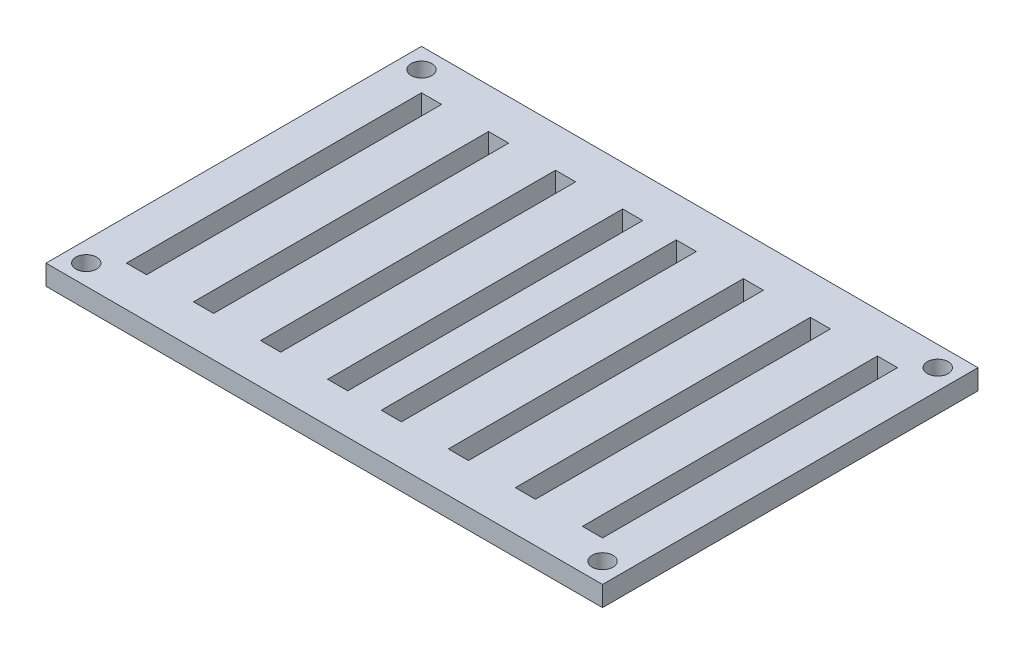
from build123d import *

# Parameters (mm, degrees)
SKETCH_1_W          = 83
SKETCH_1_H          = 56
SKETCH_1_R          = 1.55
EXTRUDE_1_DEPTH     = 3
SKETCH_3_W          = 3
SKETCH_3_H          = 44
CUT_EXTRUDE_1_DEPTH = 51.152268144


with BuildPart() as part:
    # ｽｹｯﾁ1 → ﾎﾞｽ - 押し出し1 (new body)
    with BuildSketch(Plane(origin=(0, 0, 0), x_dir=(1, 0, 0), z_dir=(0, 1, 0))):
        Rectangle(SKETCH_1_W, SKETCH_1_H)
        with Locations(Location((-38.5, 25, 0), (0, 0, 270))):
            Circle(SKETCH_1_R, mode=Mode.SUBTRACT)
        with Locations(Location((38.5, 25, 0), (0, 0, 270))):
            Circle(SKETCH_1_R, mode=Mode.SUBTRACT)
        with Locations(Location((38.5, -25, 0), (0, 0, 270))):
            Circle(SKETCH_1_R, mode=Mode.SUBTRACT)
        with Locations(Location((-38.5, -25, 0), (0, 0, 270))):
            Circle(SKETCH_1_R, mode=Mode.SUBTRACT)
    extrude(amount=EXTRUDE_1_DEPTH)

    # ｽｹｯﾁ3 → ｶｯﾄ - 押し出し1 (cut, through all)
    with BuildSketch(Plane(origin=(0, 3, 0), x_dir=(1, 0, 0), z_dir=(0, 1, 0))):
        with Locations((-34, 0)):
            Rectangle(SKETCH_3_W, SKETCH_3_H)
        with Locations((-24, 0)):
            Rectangle(SKETCH_3_W, SKETCH_3_H)
        with Locations((-14, 0)):
            Rectangle(SKETCH_3_W, SKETCH_3_H)
        with Locations((-4, 0)):
            Rectangle(SKETCH_3_W, SKETCH_3_H)
        with Locations((4, 0)):
            Rectangle(SKETCH_3_W, SKETCH_3_H)
        with Locations((14, 0)):
            Rectangle(SKETCH_3_W, SKETCH_3_H)
        with Locations((24, 0)):
            Rectangle(SKETCH_3_W, SKETCH_3_H)
        with Locations((34, 0)):
            Rectangle(SKETCH_3_W, SKETCH_3_H)
    extrude(amount=-CUT_EXTRUDE_1_DEPTH, mode=Mode.SUBTRACT)


solid = part.part
